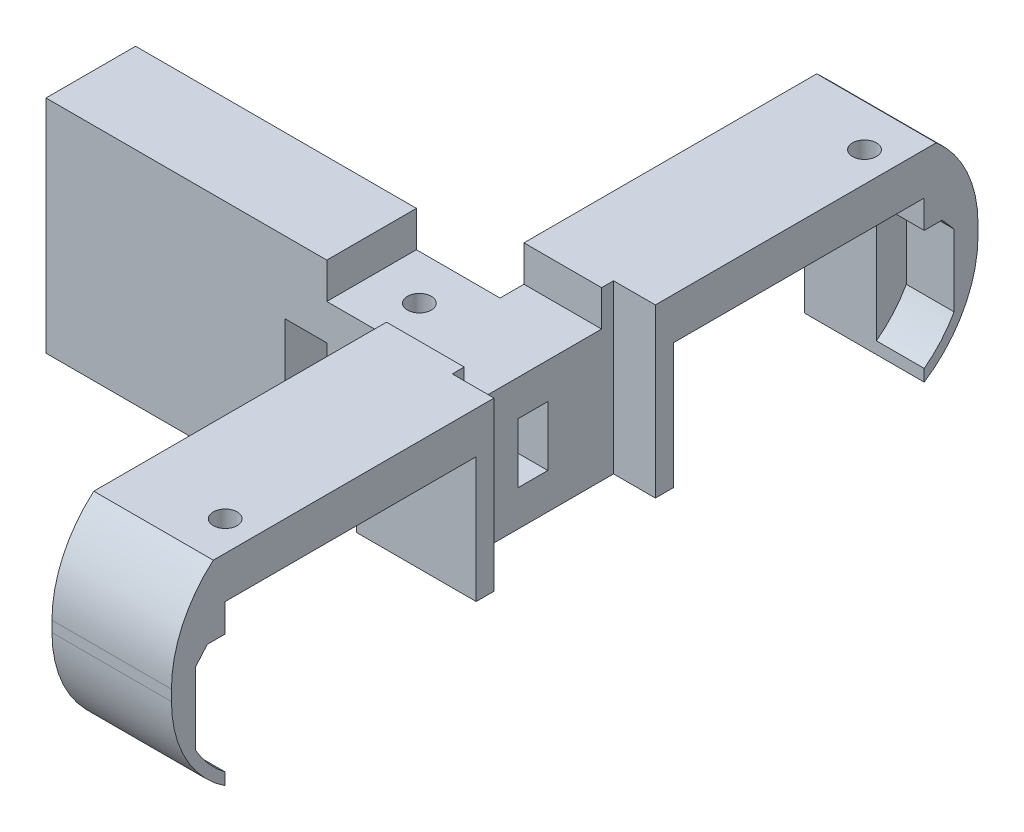
from build123d import *
from OCP.BRepFilletAPI import BRepFilletAPI_MakeChamfer

# Parameters (mm, degrees)
BOSS_EXTRUDE1_DEPTH = 37
CUT_EXTRUDE1_REACH  = 150.017
SKETCH2_W           = 42
SKETCH2_H           = 21
SKETCH3_R           = 2
CUT_EXTRUDE2_DEPTH  = 10
FILLET1_R           = 20
CUT_EXTRUDE5_REACH  = 150.017
SKETCH6_W           = 42
SKETCH6_H           = 9
SKETCH7_R           = 2
CUT_EXTRUDE6_DEPTH  = 10
CUT_EXTRUDE7_DEPTH  = 9
SKETCH9_R           = 2
CUT_EXTRUDE8_DEPTH  = 10
CUT_EXTRUDE9_DEPTH  = 6
SKETCH11_R          = 2
CUT_EXTRUDE10_DEPTH = 9
SKETCH12_R          = 2
CUT_EXTRUDE11_DEPTH = 10
CUT_EXTRUDE12_REACH = 140.091
CUT_EXTRUDE16_REACH = 142.222
SKETCH14_W          = 7
SKETCH14_H          = 27
CUT_EXTRUDE17_REACH = 108.34
SKETCH16_W          = 7
SKETCH16_H          = 10
CUT_EXTRUDE18_REACH = 146.306
SKETCH15_W          = 5
SKETCH15_H          = 10
CHAMFER1_SIZE       = 4.5
CHAMFER1_SIZE2      = 7.794228634
CUT_EXTRUDE19_DEPTH = 8


with BuildPart() as part:
    # Sketch1 → Boss-Extrude1 (new body)
    with BuildSketch(Plane(origin=(0, 0, 0), x_dir=(1, 0, 0), z_dir=(0, 1, 0))):
        Polygon((-15.317617866, 43.23325062), (45.682382134, 43.23325062), (45.682382134, -16.76674938), (65.682382134, -16.76674938), (65.682382134, 118.23325062), (45.682382134, 118.23325062), (45.682382134, 58.23325062), (-15.317617866, 58.23325062), align=None)
    extrude(amount=BOSS_EXTRUDE1_DEPTH)

    # Sketch2 → Cut-Extrude1 (cut, up to next)
    with BuildSketch(Plane(origin=(65.682382134, 0, 0), x_dir=(0, 0, -1), z_dir=(1, 0, 0)), mode=Mode.PRIVATE) as cut_extrude1_sk1:
        with Locations((13.23325062, 19.5)):
            Rectangle(SKETCH2_W, SKETCH2_H)
    cut_extrude1_tool1 = extrude(cut_extrude1_sk1.sketch, amount=-CUT_EXTRUDE1_REACH, mode=Mode.PRIVATE) & part.part
    # Sketch2 → Cut-Extrude1 (cut, up to next)
    with BuildSketch(Plane(origin=(65.682382134, 0, 0), x_dir=(0, 0, -1), z_dir=(1, 0, 0)), mode=Mode.PRIVATE) as cut_extrude1_sk2:
        with Locations((88.23325062, 19.5)):
            Rectangle(SKETCH2_W, SKETCH2_H)
    cut_extrude1_tool2 = extrude(cut_extrude1_sk2.sketch, amount=-CUT_EXTRUDE1_REACH, mode=Mode.PRIVATE) & part.part
    add(cut_extrude1_tool1.solids().sort_by_distance((65.682382, 19.5, -13.233251))[0], mode=Mode.SUBTRACT)
    add(cut_extrude1_tool2.solids().sort_by_distance((65.682382, 19.5, -88.233251))[0], mode=Mode.SUBTRACT)

    # Sketch3 → Cut-Extrude2 (cut)
    with BuildSketch(Plane.ZY.offset(-45.682382134)):
        with Locations((11.26674938, 24.75)):
            Circle(SKETCH3_R)
        with Locations((11.26674938, 15.25)):
            Circle(SKETCH3_R)
        with Locations((-37.73325062, 24.75)):
            Circle(SKETCH3_R)
        with Locations((-37.73325062, 15.25)):
            Circle(SKETCH3_R)
        with Locations(Location((-112.73325062, 24.75, 0), (0, 0, 180))):
            Circle(SKETCH3_R)
        with Locations(Location((-112.73325062, 15.25, 0), (0, 0, 180))):
            Circle(SKETCH3_R)
        with Locations(Location((-63.73325062, 15.25, 0), (0, 0, 180))):
            Circle(SKETCH3_R)
        with Locations(Location((-63.73325062, 24.75, 0), (0, 0, 180))):
            Circle(SKETCH3_R)
    extrude(amount=-CUT_EXTRUDE2_DEPTH, mode=Mode.SUBTRACT)

    # Fillet1
    fillet1_edges = [part.edges().sort_by_distance(p)[0] for p in [
        (55.682382134, 0, -118.23325062),
        (55.682382134, 0, 16.76674938),
    ]]
    fillet(fillet1_edges, radius=FILLET1_R)

    # Sketch6 → Cut-Extrude5 (cut, up to next)
    with BuildSketch(Plane(origin=(65.682382134, 0, 0), x_dir=(0, 0, -1), z_dir=(1, 0, 0)), mode=Mode.PRIVATE) as cut_extrude5_sk1:
        with Locations((13.23325062, 4.5)):
            Rectangle(SKETCH6_W, SKETCH6_H)
    cut_extrude5_tool1 = extrude(cut_extrude5_sk1.sketch, amount=-CUT_EXTRUDE5_REACH, mode=Mode.PRIVATE) & part.part
    # Sketch6 → Cut-Extrude5 (cut, up to next)
    with BuildSketch(Plane(origin=(65.682382134, 0, 0), x_dir=(0, 0, -1), z_dir=(1, 0, 0)), mode=Mode.PRIVATE) as cut_extrude5_sk2:
        with Locations((88.23325062, 4.5)):
            Rectangle(SKETCH6_W, SKETCH6_H)
    cut_extrude5_tool2 = extrude(cut_extrude5_sk2.sketch, amount=-CUT_EXTRUDE5_REACH, mode=Mode.PRIVATE) & part.part
    add(cut_extrude5_tool1.solids().sort_by_distance((65.682382, 4.5, -13.233251))[0], mode=Mode.SUBTRACT)
    add(cut_extrude5_tool2.solids().sort_by_distance((65.682382, 4.5, -88.233251))[0], mode=Mode.SUBTRACT)

    # Sketch7 → Cut-Extrude6 (cut)
    with BuildSketch(Plane.ZY.offset(15.317617866)):
        with Locations((-50.73325062, 27)):
            Circle(SKETCH7_R)
        with Locations((-50.73325062, 12)):
            Circle(SKETCH7_R)
    extrude(amount=-CUT_EXTRUDE6_DEPTH, mode=Mode.SUBTRACT)

    # Sketch8 → Cut-Extrude7 (cut)
    with BuildSketch(Plane.XZ):
        Polygon((45.682382134, -67.23325062), (45.682382134, -58.23325062), (25.682382134, -58.23325062), (25.682382134, -43.23325062), (45.682382134, -43.23325062), (45.682382134, -34.23325062), (65.682382134, -34.23325062), (65.682382134, -67.23325062), align=None)
    extrude(amount=-CUT_EXTRUDE7_DEPTH, mode=Mode.SUBTRACT)

    # Sketch9 → Cut-Extrude8 (cut)
    with BuildSketch(Plane.XZ.offset(-9)):
        with Locations(Location((55.682382134, -42.23325062, 0), (0, 0, 270))):
            Circle(SKETCH9_R)
        with Locations(Location((55.682382134, -59.23325062, 0), (0, 0, 270))):
            Circle(SKETCH9_R)
        with Locations(Location((35.682382134, -50.73325062, 0), (0, 0, 270))):
            Circle(SKETCH9_R)
    extrude(amount=-CUT_EXTRUDE8_DEPTH, mode=Mode.SUBTRACT)

    # Sketch10 → Cut-Extrude9 (cut)
    with BuildSketch(Plane(origin=(0, 37, 0), x_dir=(1, 0, 0), z_dir=(0, 1, 0))):
        Polygon((45.682382134, 62.23325062), (65.682382134, 62.23325062), (65.682382134, 39.23325062), (45.682382134, 39.23325062), (45.682382134, 43.23325062), (31.682382134, 43.23325062), (31.682382134, 58.23325062), (45.682382134, 58.23325062), align=None)
    extrude(amount=-CUT_EXTRUDE9_DEPTH, mode=Mode.SUBTRACT)

    # Sketch11 → Cut-Extrude10 (cut)
    with BuildSketch(Plane(origin=(0, 31, 0), x_dir=(1, 0, 0), z_dir=(0, 1, 0))):
        with Locations(Location((39.682382134, 50.73325062, 0), (0, 0, 270))):
            Circle(SKETCH11_R)
    extrude(amount=-CUT_EXTRUDE10_DEPTH, mode=Mode.SUBTRACT)

    # Sketch12 → Cut-Extrude11 (cut)
    with BuildSketch(Plane(origin=(0, 37, 0), x_dir=(1, 0, 0), z_dir=(0, 1, 0))):
        with Locations(Location((60.682382134, -2.76674938, 0), (0, 0, 270))):
            Circle(SKETCH12_R)
        with Locations(Location((60.682382134, 104.23325062, 0), (0, 0, 270))):
            Circle(SKETCH12_R)
    extrude(amount=-CUT_EXTRUDE11_DEPTH, mode=Mode.SUBTRACT)

    # Sketch13 → Cut-Extrude12 (cut, up to next)
    with BuildSketch(Plane.ZY.offset(-45.682382134), mode=Mode.PRIVATE) as cut_extrude12_sk1:
        with BuildLine():
            Line((-111.23325062, 37), (-118.23325062, 37))
            Line((-118.23325062, 37), (-118.23325062, 21.801315846))
            ThreePointArc((-118.23325062, 21.801315846), (-116.399152745, 30.167916112), (-111.23325062, 37))
        make_face()
    cut_extrude12_tool1 = extrude(cut_extrude12_sk1.sketch, amount=-CUT_EXTRUDE12_REACH, mode=Mode.PRIVATE) & part.part
    # Sketch13 → Cut-Extrude12 (cut, up to next)
    with BuildSketch(Plane.ZY.offset(-45.682382134), mode=Mode.PRIVATE) as cut_extrude12_sk2:
        with BuildLine():
            Line((9.76674938, 37), (16.76674938, 37))
            Line((16.76674938, 37), (16.76674938, 21.801315846))
            ThreePointArc((16.76674938, 21.801315846), (14.932651504, 30.167916112), (9.76674938, 37))
        make_face()
    cut_extrude12_tool2 = extrude(cut_extrude12_sk2.sketch, amount=-CUT_EXTRUDE12_REACH, mode=Mode.PRIVATE) & part.part
    add(cut_extrude12_tool1.solids().sort_by_distance((45.682382, 33.346132, -116.215792))[0], mode=Mode.SUBTRACT)
    add(cut_extrude12_tool2.solids().sort_by_distance((45.682382, 33.346132, 14.749291))[0], mode=Mode.SUBTRACT)

    # Sketch14 → Cut-Extrude16 (cut, up to next)
    with BuildSketch(Plane(origin=(0, 37, 0), x_dir=(1, 0, 0), z_dir=(0, 1, 0)), mode=Mode.PRIVATE) as cut_extrude16_sk1:
        with Locations((62.182382134, 50.73325062)):
            Rectangle(SKETCH14_W, SKETCH14_H)
    cut_extrude16_tool1 = extrude(cut_extrude16_sk1.sketch, amount=-CUT_EXTRUDE16_REACH, mode=Mode.PRIVATE) & part.part
    add(cut_extrude16_tool1.solids().sort_by_distance((62.182382, 37, -50.733251))[0], mode=Mode.SUBTRACT)

    # Sketch16 → Cut-Extrude17 (cut, up to next)
    with BuildSketch(Plane.XY.offset(-43.23325062), mode=Mode.PRIVATE) as cut_extrude17_sk1:
        with Locations((28.182382134, 20)):
            Rectangle(SKETCH16_W, SKETCH16_H)
    cut_extrude17_tool1 = extrude(cut_extrude17_sk1.sketch, amount=-CUT_EXTRUDE17_REACH, mode=Mode.PRIVATE) & part.part
    add(cut_extrude17_tool1.solids().sort_by_distance((28.182382, 20, -43.233251))[0], mode=Mode.SUBTRACT)

    # Sketch15 → Cut-Extrude18 (cut, up to next)
    with BuildSketch(Plane(origin=(58.682382134, 0, 0), x_dir=(0, 0, -1), z_dir=(1, 0, 0)), mode=Mode.PRIVATE) as cut_extrude18_sk1:
        with Locations((50.73325062, 20)):
            Rectangle(SKETCH15_W, SKETCH15_H)
    cut_extrude18_tool1 = extrude(cut_extrude18_sk1.sketch, amount=-CUT_EXTRUDE18_REACH, mode=Mode.PRIVATE) & part.part
    add(cut_extrude18_tool1.solids().sort_by_distance((58.682382, 20, -50.733251))[0], mode=Mode.SUBTRACT)

    # Chamfer1: one chamfer whose edges measure the first distance from different faces: ONE call of the kernel's chamfer builder (chamfer() names one face for all edges)
    chamfer1_edges_1 = [part.edges().sort_by_distance(p)[0] for p in [
        (31.682382134, 20, -53.23325062),
    ]]
    chamfer1_side_1 = [part.faces().sort_by_distance(p)[0] for p in [
        (31.682382134, 20, -55.73325062),
    ]]
    chamfer1_edges_2 = [part.edges().sort_by_distance(p)[0] for p in [
        (31.682382134, 20, -48.23325062),
    ]]
    chamfer1_side_2 = [part.faces().sort_by_distance(p)[0] for p in [
        (31.682382134, 20, -45.73325062),
    ]]
    chamfer1 = BRepFilletAPI_MakeChamfer(part.part.solid().wrapped)
    for e in chamfer1_edges_1:
        chamfer1.Add(CHAMFER1_SIZE, CHAMFER1_SIZE2, e.wrapped, chamfer1_side_1[0].wrapped)  # the first distance lies on this face
    for e in chamfer1_edges_2:
        chamfer1.Add(CHAMFER1_SIZE, CHAMFER1_SIZE2, e.wrapped, chamfer1_side_2[0].wrapped)  # the first distance lies on this face
    add(Compound.cast(chamfer1.Shape()), mode=Mode.REPLACE)

    # Sketch18 → Cut-Extrude19 (cut)
    with BuildSketch(Plane(origin=(65.682382134, 0, 0), x_dir=(0, 0, -1), z_dir=(1, 0, 0))):
        with BuildLine():
            Line((109.23325062, 25.296706912), (112.23325062, 25.296706912))
            Line((112.23325062, 25.296706912), (114.23325062, 22.989626664))
            Line((114.23325062, 22.989626664), (114.23325062, 10.989626664))
            ThreePointArc((114.23325062, 10.989626664), (112.030073944, 7.882471629), (109.23325062, 5.296706912))
            Line((109.23325062, 5.296706912), (109.23325062, 25.296706912))
        make_face()
        with BuildLine():
            Line((-7.763672274, 25.296706912), (-7.763672274, 5.296706912))
            ThreePointArc((-7.763672274, 5.296706912), (-10.560495598, 7.882471629), (-12.763672274, 10.989626664))
            Line((-12.763672274, 10.989626664), (-12.763672274, 22.989626664))
            Line((-12.763672274, 22.989626664), (-10.763672274, 25.296706912))
            Line((-10.763672274, 25.296706912), (-7.763672274, 25.296706912))
        make_face()
    extrude(amount=-CUT_EXTRUDE19_DEPTH, mode=Mode.SUBTRACT)


solid = part.part
